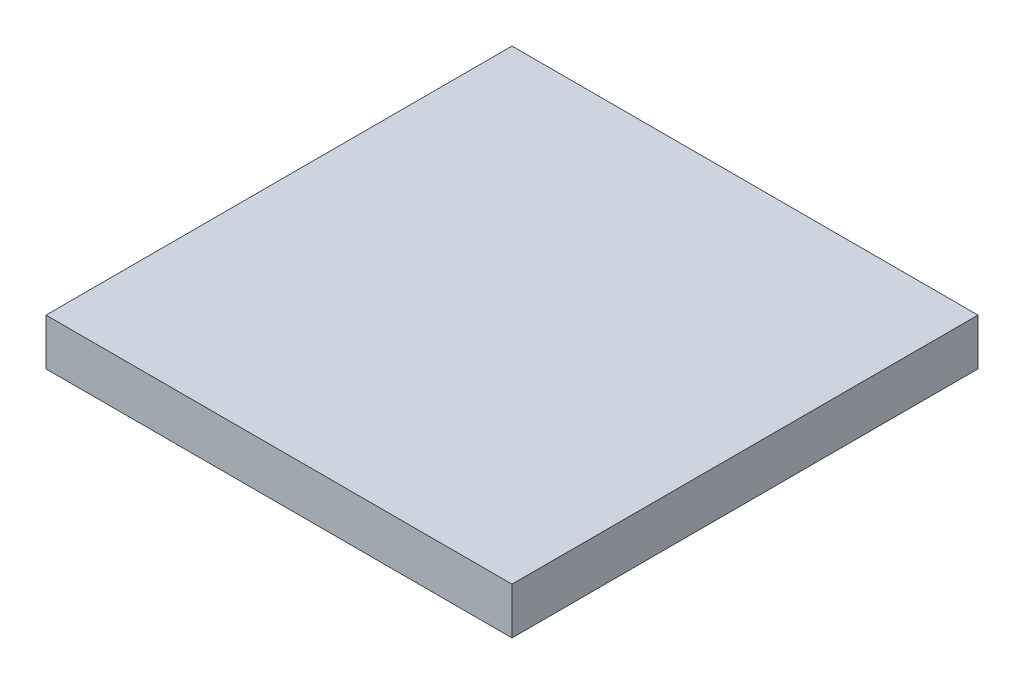
from build123d import *

# Parameters (mm, degrees)
SKETCH1_W           = 1000
SKETCH1_H           = 1000
BOSS_EXTRUDE1_DEPTH = 100


with BuildPart() as part:
    # Sketch1 → Boss-Extrude1 (new body)
    with BuildSketch(Plane(origin=(0, 0, 0), x_dir=(1, 0, 0), z_dir=(0, 1, 0))):
        with Locations((500, 500)):
            Rectangle(SKETCH1_W, SKETCH1_H)
    extrude(amount=BOSS_EXTRUDE1_DEPTH)


solid = part.part
